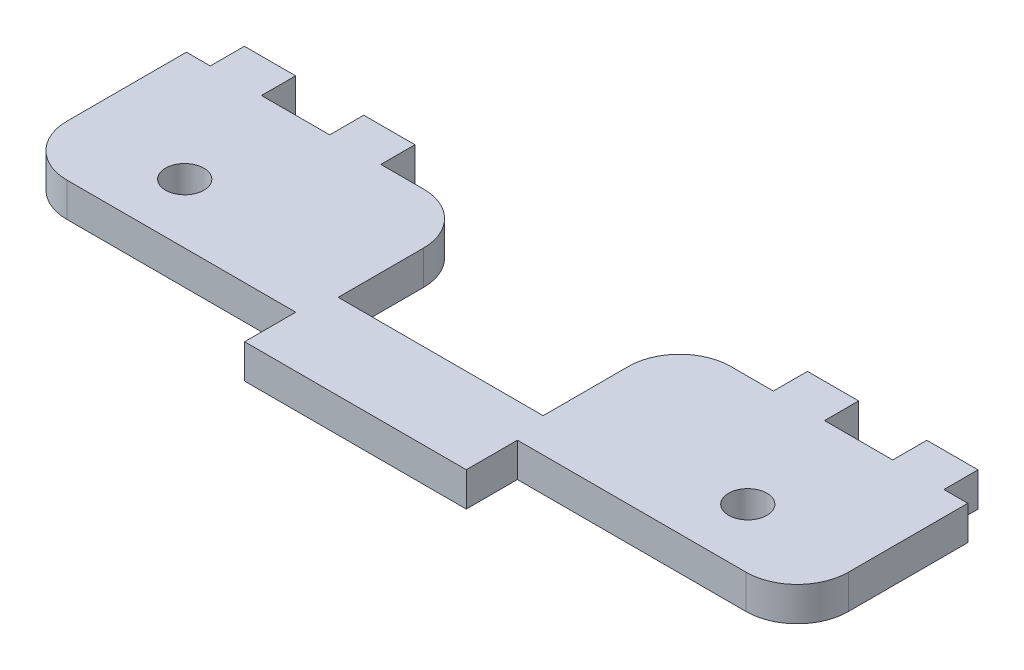
from build123d import *

# Parameters (mm, degrees)
CROQUIS1_R              = 1.125
SALIENTE_EXTRUIR1_DEPTH = 2
CROQUIS3_W              = 7
CROQUIS3_H              = 2.5
SALIENTE_EXTRUIR2_DEPTH = 2


with BuildPart() as part:
    # Croquis1 → Saliente-Extruir1 (new body)
    with BuildSketch(Plane(origin=(0, 0, 0), x_dir=(1, 0, 0), z_dir=(0, 1, 0))):
        with BuildLine():
            Line((19.91, 0), (6.5, 0))
            Line((6.5, 0), (6.5, -3))
            Line((6.5, -3), (-6.5, -3))
            Line((-6.5, -3), (-6.5, 0))
            Line((-6.5, 0), (-19.91, 0))
            ThreePointArc((-19.91, 0), (-22.031320344, 0.878679656), (-22.91, 3))
            Line((-22.91, 3), (-22.91, 10))
            Line((-22.91, 10), (-21.51, 10))
            Line((-21.51, 10), (-21.51, 12))
            Line((-21.51, 12), (-18.51, 12))
            Line((-18.51, 12), (-18.51, 10))
            Line((-18.51, 10), (-14.51, 10))
            Line((-14.51, 10), (-14.51, 12))
            Line((-14.51, 12), (-11.51, 12))
            Line((-11.51, 12), (-11.51, 10))
            Line((-11.51, 10), (-9.01, 10))
            ThreePointArc((-9.01, 10), (-6.888679656, 9.121320344), (-6.01, 7))
            Line((-6.01, 7), (-6.01, 2))
            Line((-6.01, 2), (6.01, 2))
            Line((6.01, 2), (6.01, 7))
            ThreePointArc((6.01, 7), (6.888679656, 9.121320344), (9.01, 10))
            Line((9.01, 10), (11.51, 10))
            Line((11.51, 10), (11.51, 12))
            Line((11.51, 12), (14.51, 12))
            Line((14.51, 12), (14.51, 10))
            Line((14.51, 10), (18.51, 10))
            Line((18.51, 10), (18.51, 12))
            Line((18.51, 12), (21.51, 12))
            Line((21.51, 12), (21.51, 10))
            Line((21.51, 10), (22.91, 10))
            Line((22.91, 10), (22.91, 3))
            ThreePointArc((22.91, 3), (22.031320344, 0.878679656), (19.91, 0))
        make_face()
        with Locations(Location((-16.51, 3.5, 0), (0, 0, 270))):
            Circle(CROQUIS1_R, mode=Mode.SUBTRACT)
        with Locations(Location((16.51, 3.5, 0), (0, 0, 90))):
            Circle(CROQUIS1_R, mode=Mode.SUBTRACT)
    extrude(amount=SALIENTE_EXTRUIR1_DEPTH)

    # Croquis3 → Saliente-Extruir2 (add)
    with BuildSketch(Plane.XZ):
        with Locations((-16.51, -6.75)):
            Rectangle(CROQUIS3_W, CROQUIS3_H)
        with Locations((16.51, -6.75)):
            Rectangle(CROQUIS3_W, CROQUIS3_H)
    extrude(amount=SALIENTE_EXTRUIR2_DEPTH)


solid = part.part
